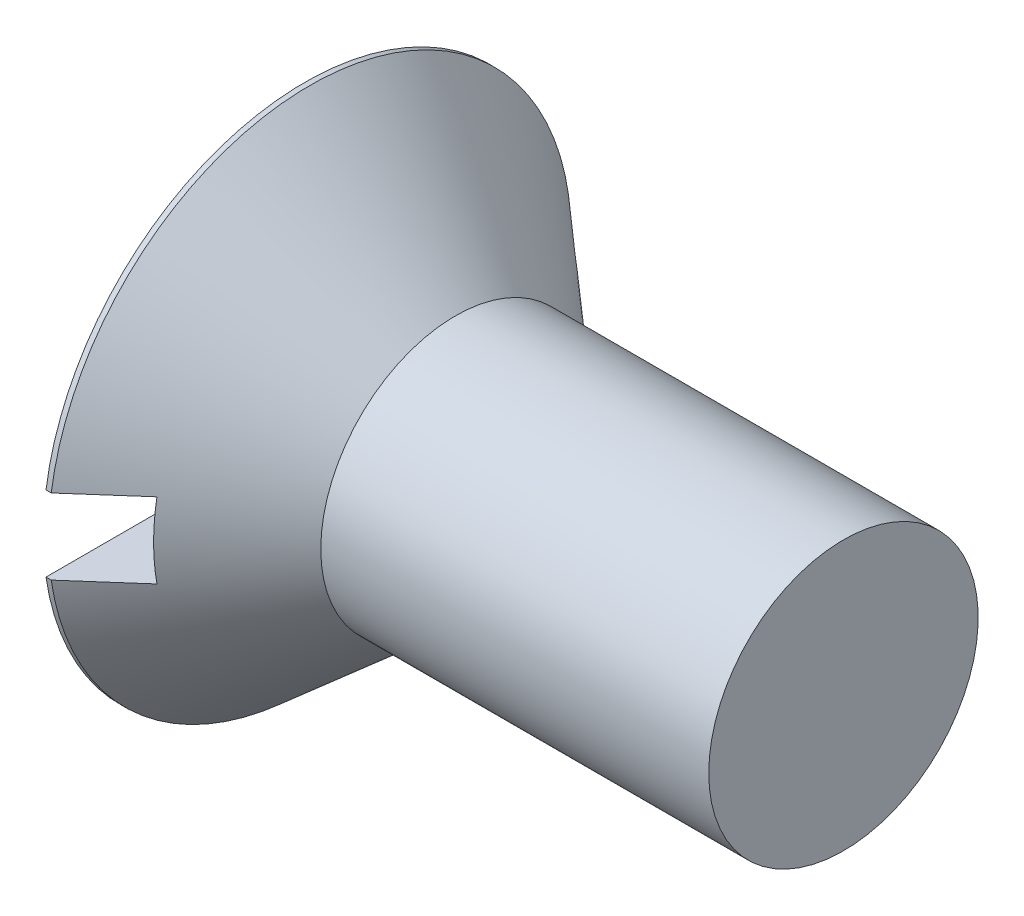
from build123d import *

# Parameters (mm, degrees)
SKETCH6_W  = 12.319
SKETCH6_H  = 1.778
SLOT_DEPTH = 1.4478


with BuildPart() as part:
    # BodySke → Base-Revolve (revolve)
    with BuildSketch(Plane.XY, mode=Mode.PRIVATE) as base_revolve_sk:
        Polygon((0, 0), (0, 6.1595), (0.122725489, 6.1595), (3.556, 3.175), (12.7, 3.175), (12.7, 0), align=None)
    revolve(base_revolve_sk.sketch.rotate(Axis((-6.35, 0, 0), (1, 0, 0)), 90), axis=Axis((-6.35, 0, 0), (1, 0, 0)))

    # Sketch6 → Slot (cut)
    with BuildSketch(Plane.ZY):
        Rectangle(SKETCH6_W, SKETCH6_H)
    extrude(amount=-SLOT_DEPTH, mode=Mode.SUBTRACT)


solid = part.part
